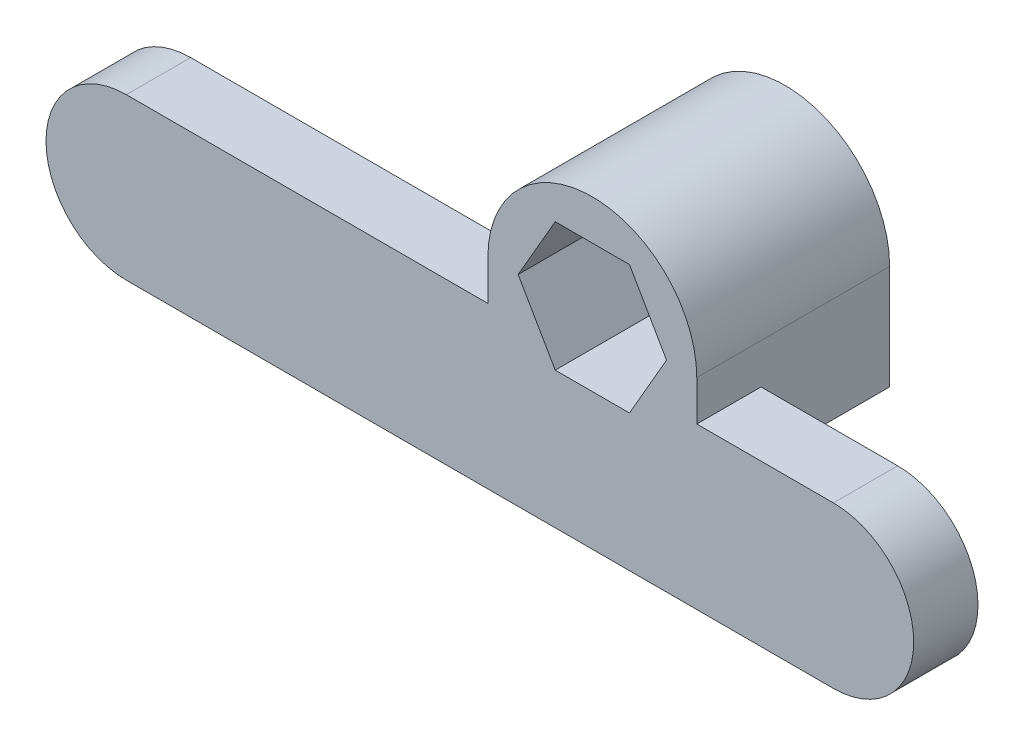
from build123d import *

# Parameters (mm, degrees)
SKETCH1_R           = 1.25
BOSS_EXTRUDE1_DEPTH = 2
SKETCH2_W           = 6
SKETCH2_H           = 2.8
BOSS_EXTRUDE2_DEPTH = 4
SKETCH3_R           = 1.25
BOSS_EXTRUDE3_DEPTH = 4
BOSS_EXTRUDE4_DEPTH = 2
CUT_EXTRUDE1_DEPTH  = 4


with BuildPart() as part:
    # Sketch1 → Boss-Extrude1 (new body)
    with BuildSketch(Plane.XY):
        with BuildLine():
            Line((-14.5, -1.25), (-3.25, -1.25))
            Line((-3.25, -1.25), (-3.25, 0))
            ThreePointArc((-3.25, 0), (0, 3.25), (3.25, 0))
            Line((3.25, 0), (3.25, -1.25))
            Line((3.25, -1.25), (7.5, -1.25))
            ThreePointArc((7.5, -1.25), (10, -3.75), (7.5, -6.25))
            Line((7.5, -6.25), (-14.5, -6.25))
            ThreePointArc((-14.5, -6.25), (-17, -3.75), (-14.5, -1.25))
        make_face()
        Circle(SKETCH1_R, mode=Mode.SUBTRACT)
    extrude(amount=BOSS_EXTRUDE1_DEPTH)

    # Sketch2 → Boss-Extrude2 (add)
    with BuildSketch(Plane.XY.offset(2)):
        with BuildLine():
            Line((-15, -6.199489743), (-15, -1.300510257))
            ThreePointArc((-15, -1.300510257), (-17, -3.75), (-15, -6.199489743))
        make_face()
        with Locations((0, -4.85)):
            Rectangle(SKETCH2_W, SKETCH2_H)
        with BuildLine():
            Line((8, -1.300510257), (8, -6.199489743))
            ThreePointArc((8, -6.199489743), (10, -3.75), (8, -1.300510257))
        make_face()
    extrude(amount=BOSS_EXTRUDE2_DEPTH)


with BuildPart() as body_2:
    # Sketch3 → Boss-Extrude3 (new body)
    with BuildSketch(Plane.XY.offset(2)):
        with BuildLine():
            Line((-3.25, 0), (-3.25, -3.25))
            Line((-3.25, -3.25), (-1.05, -3.25))
            Line((-1.05, -3.25), (-1.05, -6.25))
            Line((-1.05, -6.25), (1.05, -6.25))
            Line((1.05, -6.25), (1.05, -3.25))
            Line((1.05, -3.25), (3.25, -3.25))
            Line((3.25, -3.25), (3.25, 0))
            ThreePointArc((3.25, 0), (0, 3.25), (-3.25, 0))
        make_face()
        Circle(SKETCH3_R, mode=Mode.SUBTRACT)
    extrude(amount=BOSS_EXTRUDE3_DEPTH)

    # Sketch4 → Boss-Extrude4 (add)
    with BuildSketch(Plane.XY.offset(6)):
        with BuildLine():
            Line((7.5, -1.25), (3.25, -1.25))
            Line((3.25, -1.25), (3.25, 0))
            ThreePointArc((3.25, 0), (0, 3.25), (-3.25, 0))
            Line((-3.25, 0), (-3.25, -1.25))
            Line((-3.25, -1.25), (-14.5, -1.25))
            ThreePointArc((-14.5, -1.25), (-17, -3.75), (-14.5, -6.25))
            Line((-14.5, -6.25), (7.5, -6.25))
            ThreePointArc((7.5, -6.25), (10, -3.75), (7.5, -1.25))
        make_face()
    extrude(amount=BOSS_EXTRUDE4_DEPTH)

    # Sketch5 → Cut-Extrude1 (cut)
    with BuildSketch(Plane.XY.offset(8)):
        Polygon((1.154700538, 2), (-1.154700538, 2), (-2.309401077, 0), (-1.154700538, -2), (1.154700538, -2), (2.309401077, 0), align=None)
    extrude(amount=-CUT_EXTRUDE1_DEPTH, mode=Mode.SUBTRACT)


solid = body_2.part
